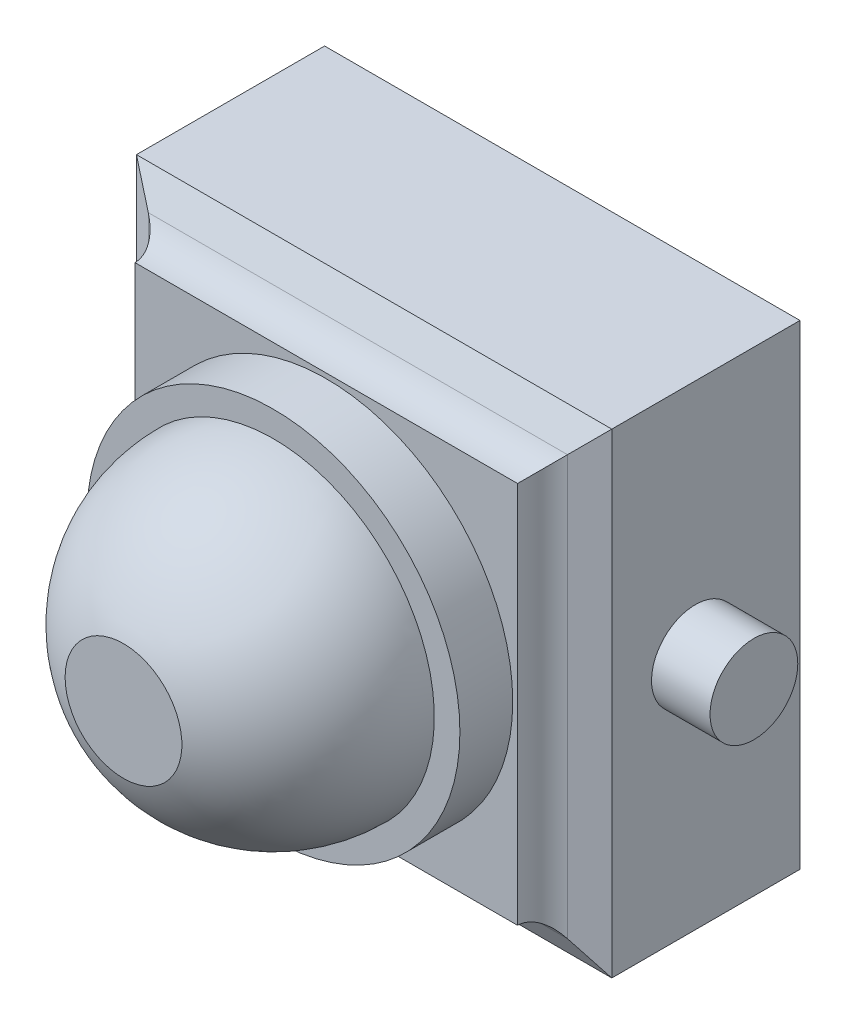
from build123d import *

# Parameters (mm, degrees)
SCHIZZO1_W                                = 65
SCHIZZO1_H                                = 65
ESTRUSIONE_ESTRUSIONE1_DEPTH              = 39.5
SCHIZZO2_R                                = 1.5
TAGLIO_ESTRUSIONE1_DEPTH                  = 5
SCHIZZO3_R                                = 6
ESTRUSIONE_ESTRUSIONE2_DEPTH              = 8
TAGLIO_ESTRUSIONE2_DEPTH                  = 32.5
RIPETIZIONECIRCOLARE1_COUNT               = 2
RIPETIZIONECIRCOLARE1_ANGLE               = 90
RIPETIZIONECIRCOLARE1_THE_OTHER_WAY_COUNT = 2
RIPETIZIONECIRCOLARE1_THE_OTHER_WAY_ANGLE = 90
SCHIZZO4_W                                = 52.3204051
SCHIZZO4_H                                = 52.3204051
SCHIZZO4_R                                = 25.5
TAGLIO_ESTRUSIONE3_DEPTH                  = 7.223249
RIVOLUZIONE2_ANGLE                        = 180
TAGLIO_ESTRUSIONE4_DEPTH                  = 81.490682691
TAGLIO_ESTRUSIONE4_DEPTH_BACK             = 81.490682691
SCHIZZO8_W                                = 20
SCHIZZO8_H                                = 2


with BuildPart() as part:
    # Schizzo1 → Estrusione-Estrusione1 (new body)
    with BuildSketch(Plane.XY):
        Rectangle(SCHIZZO1_W, SCHIZZO1_H)
    extrude(amount=ESTRUSIONE_ESTRUSIONE1_DEPTH)

    # Schizzo2 → Taglio-Estrusione1 (cut)
    with BuildSketch(Plane(origin=(0, 0, 0), x_dir=(-1, 0, 0), z_dir=(0, 0, -1))):
        with Locations((24, -18)):
            Circle(SCHIZZO2_R)
        with Locations(Location((-24, -18, 0), (0, 0, 180))):
            Circle(SCHIZZO2_R)
        with Locations((-24, 18)):
            Circle(SCHIZZO2_R)
        with Locations(Location((24, 18, 0), (0, 0, 180))):
            Circle(SCHIZZO2_R)
    extrude(amount=-TAGLIO_ESTRUSIONE1_DEPTH, mode=Mode.SUBTRACT)

    # Schizzo3 → Estrusione-Estrusione2 (add)
    with BuildSketch(Plane(origin=(32.5, 0, 0), x_dir=(0, 0, -1), z_dir=(1, 0, 0))):
        with Locations(Location((-14.3, 0, 0), (0, 0, 270))):
            Circle(SCHIZZO3_R)
    extrude(amount=ESTRUSIONE_ESTRUSIONE2_DEPTH)

    # Schizzo5 → Taglio-Estrusione2 (cut, symmetric)
    with BuildSketch(Plane.ZY):
        with BuildLine():
            Line((39.5, -32.5), (39.5, -26.16))
            Line((39.5, -26.16), (32.276751345, -26.16020255))
            ThreePointArc((32.276751345, -26.16020255), (29.77677013, -26.830145634), (27.946694431, -28.660323972))
            Line((27.946694431, -28.660323972), (25.73, -32.5))
            Line((25.73, -32.5), (39.5, -32.5))
        make_face()
    taglio_estrusione2 = extrude(amount=TAGLIO_ESTRUSIONE2_DEPTH, both=True, mode=Mode.SUBTRACT)

    # Specchia1: Taglio-Estrusione2 across plane
    add(taglio_estrusione2.mirror(Plane.ZX), mode=Mode.SUBTRACT)

    # RipetizioneCircolare1: Taglio-Estrusione2 ×2 about axis
    ripetizionecircolare1_axis = Axis((0, 0, -3), (0, 0, 1))
    for i in range(1, RIPETIZIONECIRCOLARE1_COUNT):
        add(taglio_estrusione2.rotate(ripetizionecircolare1_axis, i * RIPETIZIONECIRCOLARE1_ANGLE / (RIPETIZIONECIRCOLARE1_COUNT - 1)), mode=Mode.SUBTRACT)

    # RipetizioneCircolare1 the other way: Taglio-Estrusione2 ×2 about axis
    ripetizionecircolare1_the_other_way_axis = Axis((0, 0, -3), (0, 0, -1))
    for i in range(1, RIPETIZIONECIRCOLARE1_THE_OTHER_WAY_COUNT):
        add(taglio_estrusione2.rotate(ripetizionecircolare1_the_other_way_axis, i * RIPETIZIONECIRCOLARE1_THE_OTHER_WAY_ANGLE / (RIPETIZIONECIRCOLARE1_THE_OTHER_WAY_COUNT - 1)), mode=Mode.SUBTRACT)

    # Schizzo4 → Taglio-Estrusione3 (cut)
    with BuildSketch(Plane.XY.offset(39.5)):
        Rectangle(SCHIZZO4_W, SCHIZZO4_H)
        Circle(SCHIZZO4_R, mode=Mode.SUBTRACT)
    extrude(amount=-TAGLIO_ESTRUSIONE3_DEPTH, mode=Mode.SUBTRACT)


with BuildPart() as body_2:
    # Schizzo7 → Rivoluzione2 (revolve)
    with BuildSketch(Plane.XY.offset(39.5)):
        with BuildLine():
            ThreePointArc((0, 22), (22, 0), (0, -22))
            Line((0, -22), (0, 22))
        make_face()
    revolve(axis=Axis((0, 0, 39.5), (0, -1, 0)), revolution_arc=RIVOLUZIONE2_ANGLE)

    # Schizzo8 → Taglio-Estrusione4 (cut, two sides: drawn at the far end of the back side and taken through both)
    with BuildSketch(Plane(origin=(0, 0, 0), x_dir=(1, 0, 0), z_dir=(0, 1, 0)).offset(-TAGLIO_ESTRUSIONE4_DEPTH_BACK)):
        with Locations((0, -61)):
            Rectangle(SCHIZZO8_W, SCHIZZO8_H)
    extrude(amount=TAGLIO_ESTRUSIONE4_DEPTH + TAGLIO_ESTRUSIONE4_DEPTH_BACK, mode=Mode.SUBTRACT)


solid = Compound([part.part, body_2.part])
